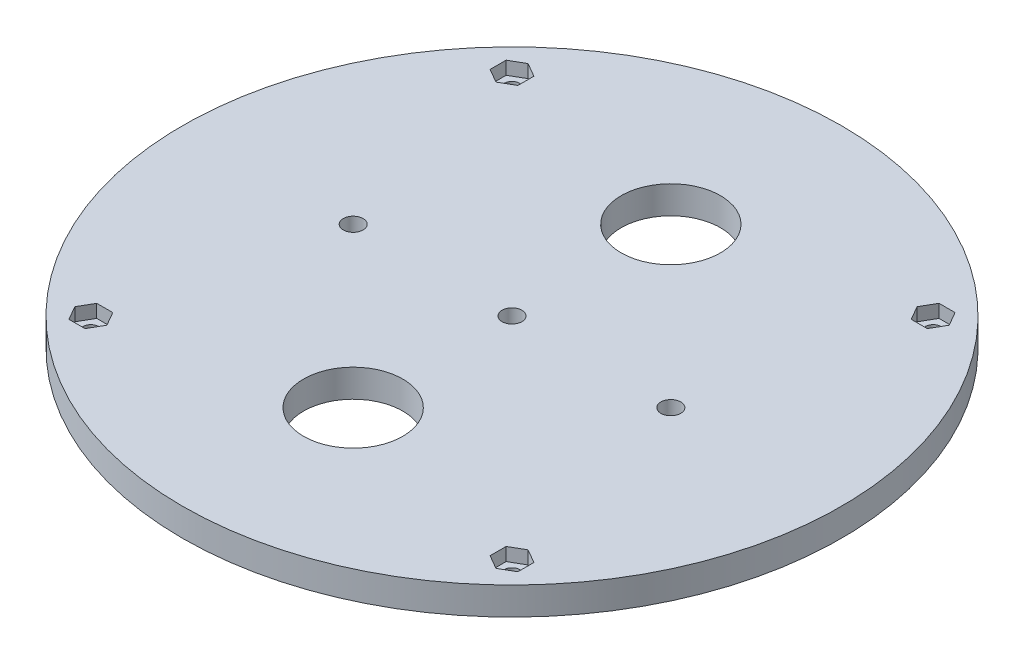
from build123d import *

# Parameters (mm, degrees)
SKETCH1_R           = 83
SKETCH1_R_2         = 12.5
BOSS_EXTRUDE1_DEPTH = 7
SKETCH14_R          = 2
CUT_EXTRUDE2_DEPTH  = 133
CUT_EXTRUDE3_DEPTH  = 3.3
SKETCH16_R          = 2.5
CUT_EXTRUDE4_DEPTH  = 10


with BuildPart() as part:
    # Sketch1 → Boss-Extrude1 (new body)
    with BuildSketch(Plane(origin=(0, 0, 0), x_dir=(1, 0, 0), z_dir=(0, 1, 0))):
        with Locations(Location((0, 0, 0), (0, 0, 270))):
            Circle(SKETCH1_R)
        with Locations(Location((0, 40, 0), (0, 0, 270))):
            Circle(SKETCH1_R_2, mode=Mode.SUBTRACT)
        with Locations(Location((0, -40, 0), (0, 0, 270))):
            Circle(SKETCH1_R_2, mode=Mode.SUBTRACT)
    extrude(amount=BOSS_EXTRUDE1_DEPTH)

    # Sketch14 → Cut-Extrude2 (cut)
    with BuildSketch(Plane(origin=(0, 7, 0), x_dir=(1, 0, 0), z_dir=(0, 1, 0))):
        with Locations(Location((-53.033008589, 53.033008589, 0), (0, 0, 270))):
            Circle(SKETCH14_R)
        with Locations(Location((53.033008589, 53.033008589, 0), (0, 0, 270))):
            Circle(SKETCH14_R)
        with Locations(Location((53.033008589, -53.033008589, 0), (0, 0, 270))):
            Circle(SKETCH14_R)
        with Locations(Location((-53.033008589, -53.033008589, 0), (0, 0, 270))):
            Circle(SKETCH14_R)
    extrude(amount=-CUT_EXTRUDE2_DEPTH, mode=Mode.SUBTRACT)

    # Sketch15 → Cut-Extrude3 (cut)
    with BuildSketch(Plane(origin=(0, 7, 0), x_dir=(1, 0, 0), z_dir=(0, 1, 0))):
        Polygon((-49.533008589, 55.053734531), (-53.033008589, 57.074460473), (-56.533008589, 55.053734531), (-56.533008589, 51.012282647), (-53.033008589, 48.991556705), (-49.533008589, 51.012282647), align=None)
        Polygon((55.053734531, 49.533008589), (57.074460473, 53.033008589), (55.053734531, 56.533008589), (51.012282647, 56.533008589), (48.991556705, 53.033008589), (51.012282647, 49.533008589), align=None)
        Polygon((49.533008589, -55.053734531), (53.033008589, -57.074460473), (56.533008589, -55.053734531), (56.533008589, -51.012282647), (53.033008589, -48.991556705), (49.533008589, -51.012282647), align=None)
        Polygon((-55.053734531, -49.533008589), (-57.074460473, -53.033008589), (-55.053734531, -56.533008589), (-51.012282647, -56.533008589), (-48.991556705, -53.033008589), (-51.012282647, -49.533008589), align=None)
    extrude(amount=-CUT_EXTRUDE3_DEPTH, mode=Mode.SUBTRACT)

    # Sketch16 → Cut-Extrude4 (cut)
    with BuildSketch(Plane(origin=(0, 7, 0), x_dir=(1, 0, 0), z_dir=(0, 1, 0))):
        with Locations(Location((-40, 0, 0), (0, 0, 270))):
            Circle(SKETCH16_R)
        with Locations(Location((40, 0, 0), (0, 0, 270))):
            Circle(SKETCH16_R)
        with Locations(Location((0, 0, 0), (0, 0, 270))):
            Circle(SKETCH16_R)
    extrude(amount=-CUT_EXTRUDE4_DEPTH, mode=Mode.SUBTRACT)


solid = part.part
